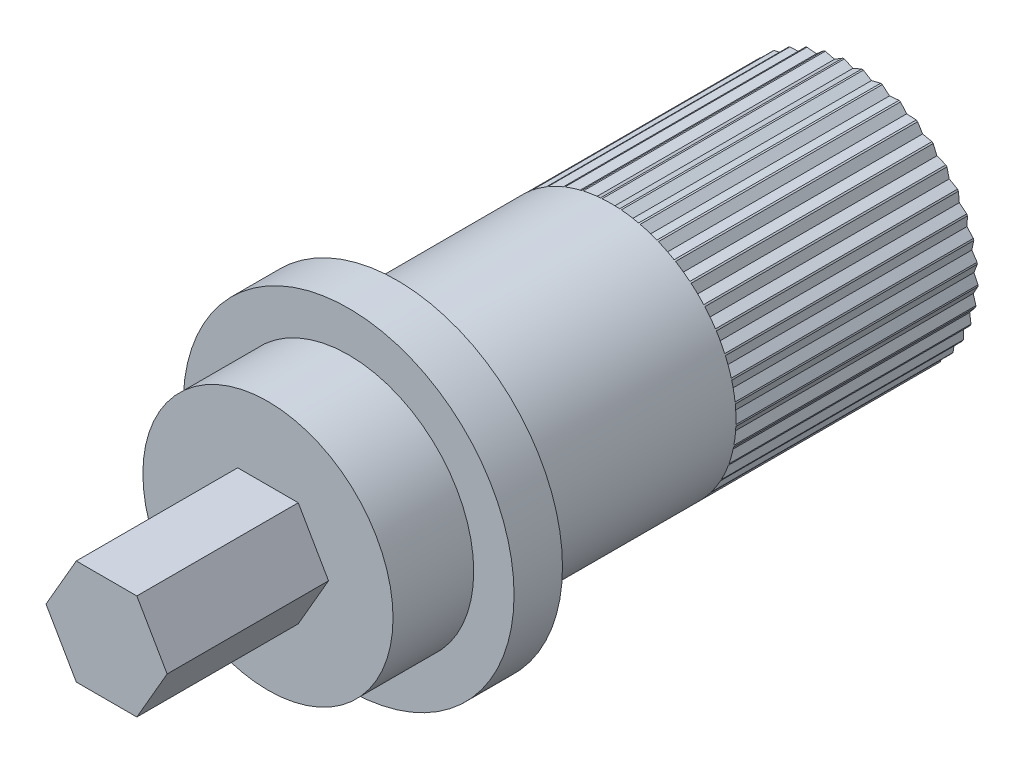
from build123d import *

# Parameters (mm, degrees)
BOSS_EXTRUDE1_SHAFTHEX_DEPTH  = 2
BOSS_EXTRUDE2_SHAFTSTOP_START = -2
SKETCH2_R                     = 3.1
BOSS_EXTRUDE2_SHAFTSTOP_DEPTH = 2
BOSS_EXTRUDE3_SHAFTBRIM_START = -4
SKETCH3_R                     = 4.1
BOSS_EXTRUDE3_SHAFTBRIM_DEPTH = 1.2
BOSS_EXTRUDE4_SHAFTKNOB_START = -5.2
SKETCH4_R                     = 3.1
BOSS_EXTRUDE4_SHAFTKNOB_DEPTH = 11.3
CUT_EXTRUDE1_SHAFTARROW_START = -16.5
SKETCH5_W                     = 0.7
SKETCH5_H                     = 2.5
CUT_EXTRUDE1_SHAFTARROW_DEPTH = 0.8
CUT_EXTRUDE3_KNOBGRIP_START   = -16.5
CUT_EXTRUDE3_KNOBGRIP_DEPTH   = 6
CUT_EXTRUDE4_START            = -16.5
SKETCH9_R                     = 2.955180547
CUT_EXTRUDE4_DEPTH            = 0.05


with BuildPart() as part:
    # Sketch1 → Boss-Extrude1_ShaftHex (new, symmetric)
    with BuildSketch(Plane.XY):
        Polygon((1.5011107, 0), (0.75055535, 1.3), (-0.75055535, 1.3), (-1.5011107, 0), (-0.75055535, -1.3), (0.75055535, -1.3), align=None)
    extrude(amount=BOSS_EXTRUDE1_SHAFTHEX_DEPTH, both=True)

    # Sketch2 → Boss-Extrude2_ShaftStop (add)
    with BuildSketch(Plane.XY.offset(BOSS_EXTRUDE2_SHAFTSTOP_START)):
        Circle(SKETCH2_R)
    extrude(amount=-BOSS_EXTRUDE2_SHAFTSTOP_DEPTH)

    # Sketch3 → Boss-Extrude3_ShaftBrim (add)
    with BuildSketch(Plane.XY.offset(BOSS_EXTRUDE3_SHAFTBRIM_START)):
        Circle(SKETCH3_R)
    extrude(amount=-BOSS_EXTRUDE3_SHAFTBRIM_DEPTH)

    # Sketch4 → Boss-Extrude4_ShaftKnob (add)
    with BuildSketch(Plane.XY.offset(BOSS_EXTRUDE4_SHAFTKNOB_START)):
        Circle(SKETCH4_R)
    extrude(amount=-BOSS_EXTRUDE4_SHAFTKNOB_DEPTH)

    # Sketch5 → Cut-Extrude1_ShaftArrow (cut)
    with BuildSketch(Plane.XY.offset(CUT_EXTRUDE1_SHAFTARROW_START)):
        with Locations((0, 1.25)):
            Rectangle(SKETCH5_W, SKETCH5_H)
        Polygon((-0.35, -0.823529412), (-0.35, 0), (-0.85, 0), align=None)
        Polygon((0.35, -0.823529412), (0.35, 0), (-0.35, 0), (-0.35, -0.823529412), (0, -1.4), align=None)
        Polygon((0.35, -0.823529412), (0.85, 0), (0.35, 0), align=None)
        Polygon((0.35, -2.5), (0.35, -0.823529412), (0, -1.4), (-0.35, -0.823529412), (-0.35, -2.5), align=None)
    extrude(amount=CUT_EXTRUDE1_SHAFTARROW_DEPTH, mode=Mode.SUBTRACT)

    # Sketch8 → Cut-Extrude3_KnobGrip (cut)
    with BuildSketch(Plane.XY.offset(CUT_EXTRUDE3_KNOBGRIP_START)):
        Polygon((-2.723387978, 1.480931437), (-2.61112382, 1.687381816), (-2.635536753, 1.433159456), (-2.835652135, 1.274481058), align=None)
        Polygon((-2.723387978, 1.480931437), (-2.61112382, 1.687381816), (-2.856297468, 1.553205327), (-2.835652135, 1.274481058), align=None)
        Polygon((-2.917534149, 1.047852323), (-2.838100182, 1.269020234), (-2.823420144, 1.014050635), (-2.996968115, 0.826684412), align=None)
        Polygon((-2.917534149, 1.047852323), (-2.838100182, 1.269020234), (-3.059918554, 1.098990655), (-2.996968115, 0.826684412), align=None)
        Polygon((-3.043295792, 0.590212438), (-2.998553881, 0.820913894), (-3.191817742, 0.619016573), (-3.088037703, 0.359510983), align=None)
        Polygon((-3.097725161, 0.118738474), (-3.088724019, 0.353566027), (-3.248903427, 0.124533268), (-3.106726304, -0.116089078), align=None)
        Polygon((-3.079546478, -0.355518619), (-3.106497083, -0.122069128), (-3.22983757, -0.372868992), (-3.052595873, -0.58896811), align=None)
        Polygon((-3.079546478, -0.355518619), (-3.106497083, -0.122069128), (-2.980206269, -0.344050276), (-3.052595873, -0.58896811), align=None)
        Polygon((-3.097725161, 0.118738474), (-3.088724019, 0.353566027), (-2.997798543, 0.114908201), (-3.106726304, -0.116089078), align=None)
        Polygon((-3.043295792, 0.590212438), (-2.998553881, 0.820913894), (-2.94512496, 0.571173327), (-3.088037703, 0.359510983), align=None)
        Polygon((-2.465407901, 1.879298774), (-2.322944929, 2.066192599), (-2.385878614, 1.818676233), (-2.607870873, 1.692404949), align=None)
        Polygon((-2.465407901, 1.879298774), (-2.322944929, 2.066192599), (-2.585727191, 1.971014183), (-2.607870873, 1.692404949), align=None)
        Polygon((-2.149640752, 2.23361694), (-1.980318178, 2.396573578), (-2.25454966, 2.342624137), (-2.318963327, 2.070660302), align=None)
        Polygon((-2.149640752, 2.23361694), (-1.980318178, 2.396573578), (-2.080297502, 2.161564781), (-2.318963327, 2.070660302), align=None)
        Polygon((-1.783487847, 2.535581018), (-1.591274447, 2.670780904), (-1.870527395, 2.659324967), (-1.975701246, 2.400381133), align=None)
        Polygon((-1.783487847, 2.535581018), (-1.591274447, 2.670780904), (-1.725955981, 2.453788082), (-1.975701246, 2.400381133), align=None)
        Polygon((-1.375531497, 2.778113227), (-1.164932592, 2.882387388), (-1.442661554, 2.913693473), (-1.586130403, 2.673839065), align=None)
        Polygon((-1.375531497, 2.778113227), (-1.164932592, 2.882387388), (-1.331159514, 2.688496671), (-1.586130403, 2.673839065), align=None)
        Polygon((-0.935333856, 2.955528815), (-0.711285704, 3.026433156), (-0.905161796, 2.860189176), (-1.159382008, 2.884624475), align=None)
        Polygon((-0.935333856, 2.955528815), (-0.711285704, 3.026433156), (-0.980980949, 3.099767474), (-1.159382008, 2.884624475), align=None)
        Polygon((-2.828761211, -1.268112775), (-2.924892341, -1.053674425), (-2.966813231, -1.330000477), (-2.732630081, -1.482551125), align=None)
        Polygon((-2.828761211, -1.268112775), (-2.924892341, -1.053674425), (-2.737510849, -1.227205912), (-2.732630081, -1.482551125), align=None)
        Polygon((-2.989185836, -0.821442657), (-3.051456489, -0.594843085), (-2.892760486, -0.794944507), (-2.926915183, -1.048042228), align=None)
        Polygon((-2.989185836, -0.821442657), (-3.051456489, -0.594843085), (-3.135067058, -0.861531519), (-2.926915183, -1.048042228), align=None)
        Polygon((-2.602032821, -1.685059405), (-2.729771195, -1.48780853), (-2.729019816, -1.767295351), (-2.474294447, -1.88231028), align=None)
        Polygon((-2.602032821, -1.685059405), (-2.729771195, -1.48780853), (-2.518096278, -1.63070265), (-2.474294447, -1.88231028), align=None)
        Polygon((-2.314314987, -2.062509671), (-2.470666527, -1.887069663), (-2.239659665, -1.9959771), (-2.157963447, -2.237949678), align=None)
        Polygon((-2.314314987, -2.062509671), (-2.470666527, -1.887069663), (-2.42726049, -2.16316632), (-2.157963447, -2.237949678), align=None)
        Polygon((-0.473212781, 3.063669314), (-0.240966881, 3.099541896), (-0.457947853, 2.964841271), (-0.705458681, 3.027796732), align=None)
        Polygon((-0.473212781, 3.063669314), (-0.240966881, 3.099541896), (-0.496306982, 3.213185552), (-0.705458681, 3.027796732), align=None)
        Polygon((0, 3), (-0.235, 3.1), (0, 3.1), (0.235, 3.1), align=None)
        Polygon((0.235, 3.1), (0, 3.251289285), (-0.235, 3.1), (0, 3.1), align=None)
        Polygon((0.473212781, 3.063669314), (0.705458681, 3.027796732), (0.496306982, 3.213185552), (0.240966881, 3.099541896), align=None)
        Polygon((0.473212781, 3.063669314), (0.705458681, 3.027796732), (0.457947853, 2.964841271), (0.240966881, 3.099541896), align=None)
        Polygon((0.935333856, 2.955528815), (1.159382008, 2.884624475), (0.980980949, 3.099767474), (0.711285704, 3.026433156), align=None)
        Polygon((0.935333856, 2.955528815), (1.159382008, 2.884624475), (0.905161796, 2.860189176), (0.711285704, 3.026433156), align=None)
        Polygon((1.375531497, 2.778113227), (1.586130403, 2.673839065), (1.442661554, 2.913693473), (1.164932592, 2.882387388), align=None)
        Polygon((1.375531497, 2.778113227), (1.586130403, 2.673839065), (1.331159514, 2.688496671), (1.164932592, 2.882387388), align=None)
        Polygon((1.783487847, 2.535581018), (1.975701246, 2.400381133), (1.870527395, 2.659324967), (1.591274447, 2.670780904), align=None)
        Polygon((1.783487847, 2.535581018), (1.975701246, 2.400381133), (1.725955981, 2.453788082), (1.591274447, 2.670780904), align=None)
        Polygon((2.149640752, 2.23361694), (2.318963327, 2.070660302), (2.25454966, 2.342624137), (1.980318178, 2.396573578), align=None)
        Polygon((2.149640752, 2.23361694), (2.318963327, 2.070660302), (2.080297502, 2.161564781), (1.980318178, 2.396573578), align=None)
        Polygon((2.465407901, 1.879298774), (2.607870873, 1.692404949), (2.585727191, 1.971014183), (2.322944929, 2.066192599), align=None)
        Polygon((2.465407901, 1.879298774), (2.607870873, 1.692404949), (2.385878614, 1.818676233), (2.322944929, 2.066192599), align=None)
        Polygon((2.723387978, 1.480931437), (2.835652135, 1.274481058), (2.856297468, 1.553205327), (2.61112382, 1.687381816), align=None)
        Polygon((2.723387978, 1.480931437), (2.835652135, 1.274481058), (2.635536753, 1.433159456), (2.61112382, 1.687381816), align=None)
        Polygon((2.917534149, 1.047852323), (2.996968115, 0.826684412), (3.059918554, 1.098990655), (2.838100182, 1.269020234), align=None)
        Polygon((2.917534149, 1.047852323), (2.996968115, 0.826684412), (2.823420144, 1.014050635), (2.838100182, 1.269020234), align=None)
        Polygon((3.043295792, 0.590212438), (3.088037703, 0.359510983), (3.191817742, 0.619016573), (2.998553881, 0.820913894), align=None)
        Polygon((3.043295792, 0.590212438), (3.088037703, 0.359510983), (2.94512496, 0.571173327), (2.998553881, 0.820913894), align=None)
        Polygon((3.097725161, 0.118738474), (3.106726304, -0.116089078), (3.248903427, 0.124533268), (3.088724019, 0.353566027), align=None)
        Polygon((3.097725161, 0.118738474), (3.106726304, -0.116089078), (2.997798543, 0.114908201), (3.088724019, 0.353566027), align=None)
        Polygon((3.079546478, -0.355518619), (3.052595873, -0.58896811), (3.22983757, -0.372868992), (3.106497083, -0.122069128), align=None)
        Polygon((2.989185836, -0.821442657), (2.926915183, -1.048042228), (3.135067058, -0.861531519), (3.051456489, -0.594843085), align=None)
        Polygon((2.828761211, -1.268112775), (2.732630081, -1.482551125), (2.966813231, -1.330000477), (2.924892341, -1.053674425), align=None)
        Polygon((2.602032821, -1.685059405), (2.474294447, -1.88231028), (2.729019816, -1.767295351), (2.729771195, -1.48780853), align=None)
        Polygon((2.602032821, -1.685059405), (2.474294447, -1.88231028), (2.518096278, -1.63070265), (2.729771195, -1.48780853), align=None)
        Polygon((2.828761211, -1.268112775), (2.732630081, -1.482551125), (2.737510849, -1.227205912), (2.924892341, -1.053674425), align=None)
        Polygon((2.989185836, -0.821442657), (2.926915183, -1.048042228), (2.892760486, -0.794944507), (3.051456489, -0.594843085), align=None)
        Polygon((3.079546478, -0.355518619), (3.052595873, -0.58896811), (2.980206269, -0.344050276), (3.106497083, -0.122069128), align=None)
        Polygon((1.972351571, -2.391616457), (1.791051614, -2.541133431), (2.068608235, -2.508334504), (2.153651528, -2.242099484), align=None)
        Polygon((1.584157906, -2.664665782), (1.382159049, -2.784755171), (1.661469557, -2.794709453), (1.786156764, -2.544576392), align=None)
        Polygon((1.158832923, -2.875257598), (0.940869847, -2.96310461), (1.21538744, -3.015578781), (1.376795999, -2.787410587), align=None)
        Polygon((0.706345878, -3.018455814), (0.477527453, -3.072001389), (0.740817672, -3.165765499), (0.935164302, -2.964910239), align=None)
        Polygon((0.237302684, -3.090903984), (0.002992221, -3.108893058), (0.248883766, -3.241749356), (0.471613147, -3.072914909), align=None)
        Polygon((-0.237302684, -3.090903984), (-0.471613147, -3.072914909), (-0.248883766, -3.241749356), (-0.002992221, -3.108893058), align=None)
        Polygon((-0.237302684, -3.090903984), (-0.471613147, -3.072914909), (-0.229647759, -2.991197404), (-0.002992221, -3.108893058), align=None)
        Polygon((0.237302684, -3.090903984), (0.002992221, -3.108893058), (0.229647759, -2.991197404), (0.471613147, -3.072914909), align=None)
        Polygon((1.158832923, -2.875257598), (0.940869847, -2.96310461), (1.121451216, -2.782507353), (1.376795999, -2.787410587), align=None)
        Polygon((1.584157906, -2.664665782), (1.382159049, -2.784755171), (1.533056038, -2.578708821), (1.786156764, -2.544576392), align=None)
        Polygon((2.314314987, -2.062509671), (2.157963447, -2.237949678), (2.42726049, -2.16316632), (2.470666527, -1.887069663), align=None)
        Polygon((2.314314987, -2.062509671), (2.157963447, -2.237949678), (2.239659665, -1.9959771), (2.470666527, -1.887069663), align=None)
        Polygon((1.972351571, -2.391616457), (1.791051614, -2.541133431), (1.908727327, -2.314467539), (2.153651528, -2.242099484), align=None)
        Polygon((0.706345878, -3.018455814), (0.477527453, -3.072001389), (0.683560527, -2.921086272), (0.935164302, -2.964910239), align=None)
        Polygon((-0.706345878, -3.018455814), (-0.935164302, -2.964910239), (-0.740817672, -3.165765499), (-0.477527453, -3.072001389), align=None)
        Polygon((-1.972351571, -2.391616457), (-2.153651528, -2.242099484), (-1.908727327, -2.314467539), (-1.791051614, -2.541133431), align=None)
        Polygon((-1.584157906, -2.664665782), (-1.786156764, -2.544576392), (-1.533056038, -2.578708821), (-1.382159049, -2.784755171), align=None)
        Polygon((-1.158832923, -2.875257598), (-1.376795999, -2.787410587), (-1.121451216, -2.782507353), (-0.940869847, -2.96310461), align=None)
        Polygon((-0.706345878, -3.018455814), (-0.935164302, -2.964910239), (-0.683560527, -2.921086272), (-0.477527453, -3.072001389), align=None)
        Polygon((-1.158832923, -2.875257598), (-1.376795999, -2.787410587), (-1.21538744, -3.015578781), (-0.940869847, -2.96310461), align=None)
        Polygon((-1.584157906, -2.664665782), (-1.786156764, -2.544576392), (-1.661469557, -2.794709453), (-1.382159049, -2.784755171), align=None)
        Polygon((-1.972351571, -2.391616457), (-2.153651528, -2.242099484), (-2.068608235, -2.508334504), (-1.791051614, -2.541133431), align=None)
    extrude(amount=CUT_EXTRUDE3_KNOBGRIP_DEPTH, mode=Mode.SUBTRACT)

    # Sketch9 → Cut-Extrude4 (cut)
    with BuildSketch(Plane.XY.offset(CUT_EXTRUDE4_START)):
        Circle(SKETCH9_R)
    extrude(amount=CUT_EXTRUDE4_DEPTH, mode=Mode.SUBTRACT)


solid = part.part
